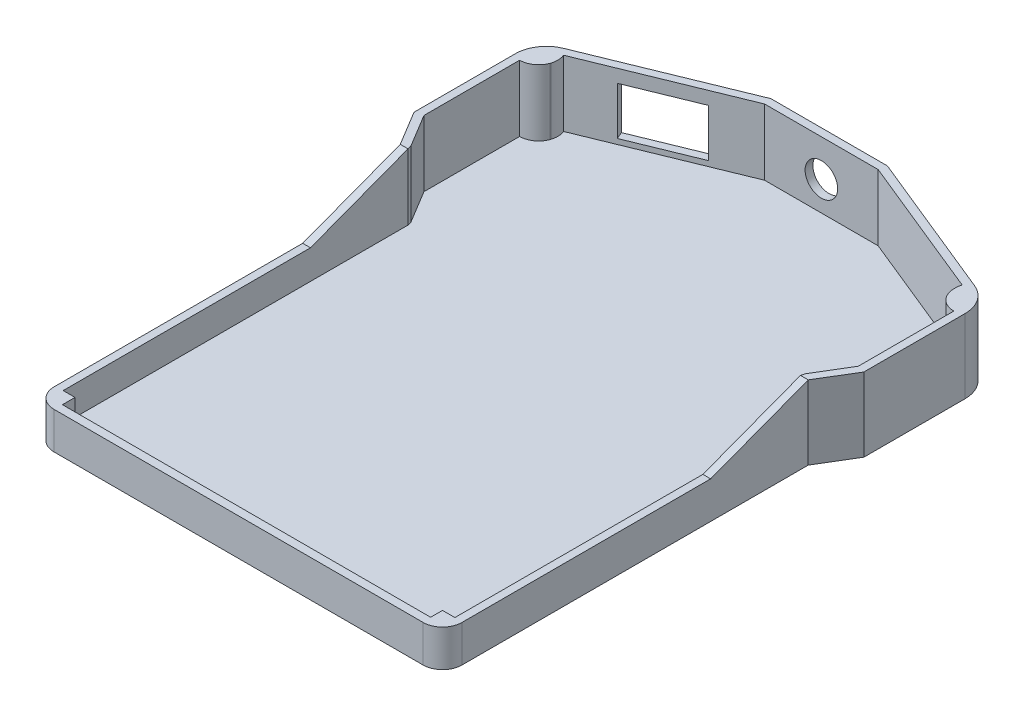
from build123d import *

# Parameters (mm, degrees)
SKETCH2_W           = 105
SKETCH2_H           = 25.118100445
BOSS_EXTRUDE2_DEPTH = 19
CUT_EXTRUDE13_DEPTH = 119
CUT_EXTRUDE15_DEPTH = 17
CUT_EXTRUDE17_DEPTH = 92
SKETCH8_R           = 4.186209529
CUT_EXTRUDE18_DEPTH = 92
BOSS_EXTRUDE3_DEPTH = 17
BOSS_EXTRUDE4_DEPTH = 17
SKETCH13_W          = 3.185616736
SKETCH13_H          = 3.062466768
BOSS_EXTRUDE6_DEPTH = 7.5
SKETCH14_W          = 3.051402249
SKETCH14_H          = 3.23810325
BOSS_EXTRUDE7_DEPTH = 7.5
FILLET1_R           = 5
FILLET2_R           = 5
FILLET5_R           = 8
FILLET6_R           = 8
SKETCH18_W          = 18
SKETCH18_H          = 12.3
CUT_EXTRUDE19_DEPTH = 15


with BuildPart() as part:
    # Sketch2 → Boss-Extrude2 (new body)
    with BuildSketch(Plane(origin=(0, 0, 0), x_dir=(1, 0, 0), z_dir=(0, 1, 0))):
        Polygon((-15, 76), (15, 76), (57.894125565, 58.485388954), (57.894125565, 27.051844623), (52.5, 18.118100445), (-52.5, 18.118100445), (-57.894125565, 27.051844623), (-57.894125565, 58.485388954), align=None)
        Polygon((52.5, -7), (-52.5, -7), (-52.5, -76), (0, -76), (15, -76), (52.5, -76), align=None)
        with Locations((0, 5.559050222)):
            Rectangle(SKETCH2_W, SKETCH2_H)
    extrude(amount=BOSS_EXTRUDE2_DEPTH)

    # Sketch4 → Cut-Extrude13 (cut)
    with BuildSketch(Plane(origin=(52.5, 0, 0), x_dir=(0, 0, -1), z_dir=(1, 0, 0))):
        Polygon((-76, 19), (-76, 9.5), (-7, 9.5), (18.118100445, 19), align=None)
    extrude(amount=-CUT_EXTRUDE13_DEPTH, mode=Mode.SUBTRACT)

    # Sketch5 → Cut-Extrude15 (cut)
    with BuildSketch(Plane(origin=(0, 19, 0), x_dir=(1, 0, 0), z_dir=(0, 1, 0))):
        Polygon((14.607411336, 74), (-14.607411336, 74), (-55.894125565, 57.141730213), (-55.894125565, 27.608811041), (-50.787885255, 19.151862072), (-50.5, 18.118100445), (50.5, 18.118100445), (50.787885255, 19.151862072), (55.894125565, 27.608811041), (55.894125565, 57.141730213), align=None)
    extrude(amount=-CUT_EXTRUDE15_DEPTH, mode=Mode.SUBTRACT)

    # Sketch7 → Cut-Extrude17 (cut)
    with BuildSketch(Plane(origin=(0, 0, -18.118100445), x_dir=(-1, 0, 0), z_dir=(0, 0, -1))):
        Polygon((50.5, 19), (50.5, 2), (11.545363278, 2), (-50.5, 2), (-50.5, 19), align=None)
    extrude(amount=-CUT_EXTRUDE17_DEPTH, mode=Mode.SUBTRACT)

    # Sketch8 → Cut-Extrude18 (cut)
    with BuildSketch(Plane(origin=(0, 0, -76), x_dir=(-1, 0, 0), z_dir=(0, 0, -1))):
        with Locations((0, 9.5)):
            Circle(SKETCH8_R)
    extrude(amount=-CUT_EXTRUDE18_DEPTH, mode=Mode.SUBTRACT)

    # Sketch11 → Boss-Extrude3 (add)
    with BuildSketch(Plane(origin=(0, 2, 0), x_dir=(1, 0, 0), z_dir=(0, 1, 0))):
        with BuildLine():
            Line((-51.347688624, 58.998140004), (-55.894125565, 57.141730213))
            Line((-55.894125565, 57.141730213), (-55.894125565, 52.230890552))
            ThreePointArc((-55.894125565, 52.230890552), (-53.106377647, 53.09885899), (-51.304073105, 55.395945406))
            Line((-51.304073105, 55.395945406), (-51.233975943, 55.592746134))
            ThreePointArc((-51.233975943, 55.592746134), (-50.986021462, 57.305621291), (-51.347688624, 58.998140004))
        make_face()
    extrude(amount=BOSS_EXTRUDE3_DEPTH)

    # Sketch12 → Boss-Extrude4 (add)
    with BuildSketch(Plane(origin=(0, 2, 0), x_dir=(1, 0, 0), z_dir=(0, 1, 0))):
        with BuildLine():
            Line((50.942379366, 58.29851863), (50.942379366, 57.141730213))
            ThreePointArc((50.942379366, 57.141730213), (52.392712249, 53.640316897), (55.894125565, 52.189984014))
            Line((55.894125565, 52.189984014), (55.894125565, 57.141730213))
            Line((55.894125565, 57.141730213), (51.18638565, 59.064003541))
            ThreePointArc((51.18638565, 59.064003541), (51.049240656, 58.686087709), (50.942379366, 58.29851863))
        make_face()
    extrude(amount=BOSS_EXTRUDE4_DEPTH)

    # Sketch13 → Boss-Extrude6 (add)
    with BuildSketch(Plane(origin=(0, 2, 0), x_dir=(1, 0, 0), z_dir=(0, 1, 0))):
        with Locations((48.907191632, -72.350666171)):
            Rectangle(SKETCH13_W, SKETCH13_H)
    extrude(amount=BOSS_EXTRUDE6_DEPTH)

    # Sketch14 → Boss-Extrude7 (add)
    with BuildSketch(Plane(origin=(0, 2, 0), x_dir=(1, 0, 0), z_dir=(0, 1, 0))):
        with Locations((-48.974298875, -72.26284793)):
            Rectangle(SKETCH14_W, SKETCH14_H)
    extrude(amount=BOSS_EXTRUDE7_DEPTH)

    # Fillet1
    fillet1_edges = [part.edges().sort_by_distance(p)[0] for p in [
        (-52.5, 4.75, 76),
    ]]
    fillet(fillet1_edges, radius=FILLET1_R)

    # Fillet2
    fillet2_edges = [part.edges().sort_by_distance(p)[0] for p in [
        (52.5, 4.75, 76),
    ]]
    fillet(fillet2_edges, radius=FILLET2_R)

    # Fillet5
    fillet5_edges = [part.edges().sort_by_distance(p)[0] for p in [
        (57.894125565, 9.5, -58.485388954),
    ]]
    fillet(fillet5_edges, radius=FILLET5_R)

    # Fillet6
    fillet6_edges = [part.edges().sort_by_distance(p)[0] for p in [
        (-57.894125565, 9.5, -58.485388954),
    ]]
    fillet(fillet6_edges, radius=FILLET6_R)

    # Sketch18 → Cut-Extrude19 (cut)
    with BuildSketch(Plane(origin=(-28.741404632, 0, -70.389083489), x_dir=(-0.925796249814304, 0, 0.37802288797078276), z_dir=(-0.37802288797078276, 0, -0.925796249814304))):
        with Locations((5.635958996, 9.5)):
            Rectangle(SKETCH18_W, SKETCH18_H)
    extrude(amount=-CUT_EXTRUDE19_DEPTH, mode=Mode.SUBTRACT)


solid = part.part
